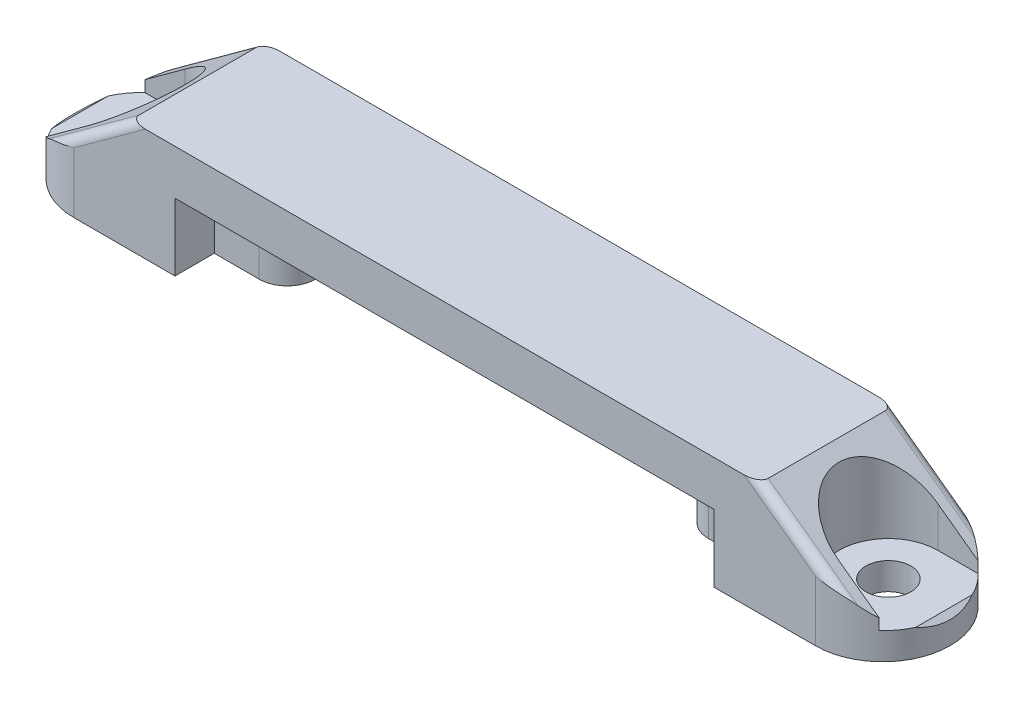
from build123d import *

# Parameters (mm, degrees)
AUFSATZ_LINEAR_AUSTRAGEN1_DEPTH = 6
SKIZZE4_R                       = 1
SCHNITT_LINEAR_AUSTRAGEN1_DEPTH = 3
SCHNITT_LINEAR_AUSTRAGEN2_DEPTH = 3.8
VERRUNDUNG1_R                   = 0.4
SCHNITT_LINEAR_AUSTRAGEN6_DEPTH = 6
AUFSATZ_LINEAR_AUSTRAGEN2_DEPTH = 3


with BuildPart() as part:
    # Skizze1 → Aufsatz-Linear austragen1 (new body)
    with BuildSketch(Plane.XY):
        Polygon((0, 0), (7.5, 0), (7.5, 3), (31.5, 3), (31.5, 0), (39, 0), (39, 1), (33.5, 5), (5.5, 5), (0, 1), align=None)
    extrude(amount=AUFSATZ_LINEAR_AUSTRAGEN1_DEPTH)

    # Skizze4 → Schnitt-Linear austragen1 (cut)
    with BuildSketch(Plane.XZ):
        with Locations(Location((36.25, 3, 0), (0, 0, 270))):
            Circle(SKIZZE4_R)
    schnitt_linear_austragen1 = extrude(amount=-SCHNITT_LINEAR_AUSTRAGEN1_DEPTH, mode=Mode.SUBTRACT)

    # Skizze5 → Schnitt-Linear austragen2 (cut)
    with BuildSketch(Plane(origin=(0, 5, 0), x_dir=(-1, 0, 0), z_dir=(0, -1, 0))):
        with BuildLine():
            Line((-36.25, -5.2), (-39, -5.2))
            Line((-39, -5.2), (-39, -0.8))
            Line((-39, -0.8), (-36.25, -0.8))
            ThreePointArc((-36.25, -0.8), (-34.05, -3), (-36.25, -5.2))
        make_face()
    schnitt_linear_austragen2 = extrude(amount=SCHNITT_LINEAR_AUSTRAGEN2_DEPTH, mode=Mode.SUBTRACT)

    # Spiegeln1: Schnitt-Linear austragen1, Schnitt-Linear austragen2 across plane
    add(schnitt_linear_austragen1.mirror(Plane.ZY.offset(-19.5)), mode=Mode.SUBTRACT)
    add(schnitt_linear_austragen2.mirror(Plane.ZY.offset(-19.5)), mode=Mode.SUBTRACT)

    # Verrundung1
    verrundung1_edges = [part.edges().sort_by_distance(p)[0] for p in [
        (36.25, 3, 0),
        (36.25, 3, 6),
        (2.75, 3, 6),
        (2.75, 3, 0),
    ]]
    fillet(verrundung1_edges, radius=VERRUNDUNG1_R)

    # Skizze10 → Schnitt-Linear austragen6 (cut)
    with BuildSketch(Plane(origin=(0, 5, 0), x_dir=(-1, 0, 0), z_dir=(0, -1, 0))):
        with BuildLine():
            Line((-36, 0), (-39, 0))
            Line((-39, 0), (-39.338530881, 0))
            Line((-39.338530881, 0), (-39.338530881, -6))
            Line((-39.338530881, -6), (-36, -6))
            ThreePointArc((-36, -6), (-39, -3), (-36, 0))
        make_face()
    schnitt_linear_austragen6 = extrude(amount=SCHNITT_LINEAR_AUSTRAGEN6_DEPTH, mode=Mode.SUBTRACT)

    # Spiegeln2: Schnitt-Linear austragen6 across plane
    add(schnitt_linear_austragen6.mirror(Plane.ZY.offset(-19.5)), mode=Mode.SUBTRACT)

    # Skizze12 → Aufsatz-Linear austragen2 (add)
    with BuildSketch(Plane.XZ.offset(-3)):
        with BuildLine():
            Line((31.5, 1.75), (29.5, 1.75))
            ThreePointArc((29.5, 1.75), (28.25, 3), (29.5, 4.25))
            Line((29.5, 4.25), (31.5, 4.25))
            Line((31.5, 4.25), (31.5, 1.75))
        make_face()
    aufsatz_linear_austragen2 = extrude(amount=AUFSATZ_LINEAR_AUSTRAGEN2_DEPTH)

    # Spiegeln3: Aufsatz-Linear austragen2 across plane
    add(aufsatz_linear_austragen2.mirror(Plane.ZY.offset(-19.5)))


solid = part.part
